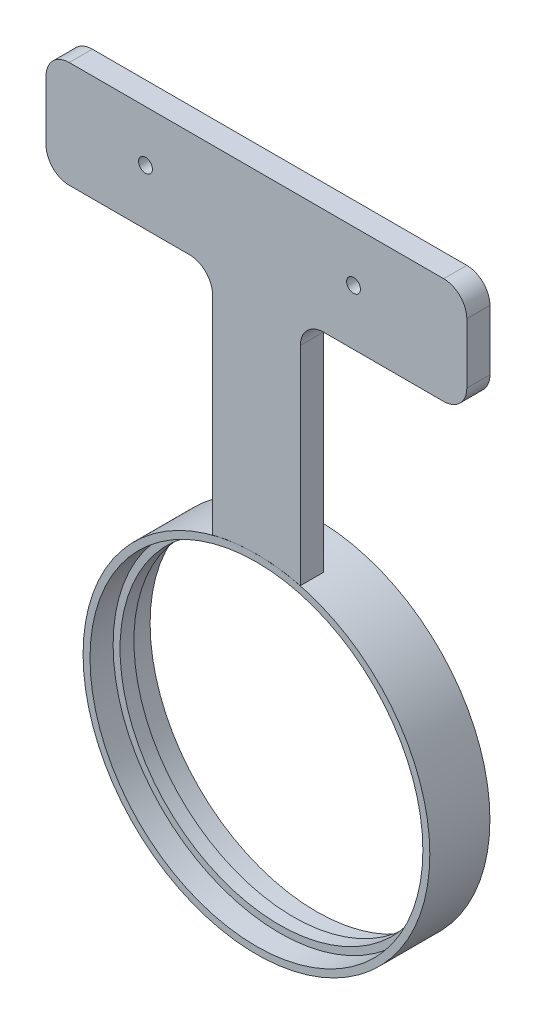
from build123d import *

# Parameters (mm, degrees)
ESQUISSE1_W                = 91
ESQUISSE1_H                = 73
BOSS_EXTRU_1_DEPTH         = 5
ENL_V_MAT_EXTRU_2_DEPTH    = 10
ENL_V_MAT_EXTRU_3_DEPTH    = 10
ESQUISSE4_R                = 37.5
BOSS_EXTRU_2_DEPTH         = 13
ESQUISSE5_R                = 36
ENL_V_MAT_EXTRU_4_DEPTH    = 5
R_P_TITION_LIN_AIRE1_COUNT = 2
R_P_TITION_LIN_AIRE1_PITCH = 8
ESQUISSE6_R                = 34.5
ENL_V_MAT_EXTRU_5_DEPTH    = 5
ENL_V_MAT_EXTRU_6_DEPTH    = 5
CONG_1_R                   = 5
ESQUISSE8_R                = 1.5
ENL_V_MAT_EXTRU_7_DEPTH    = 5


with BuildPart() as part:
    # Esquisse1 → Boss.-Extru.1 (new body)
    with BuildSketch(Plane.XY):
        with Locations((45.5, 36.5)):
            Rectangle(ESQUISSE1_W, ESQUISSE1_H)
    extrude(amount=BOSS_EXTRU_1_DEPTH)

    # Esquisse2 → Enlèv. mat.-Extru.2 (cut)
    with BuildSketch(Plane.XY.offset(5)):
        with BuildLine():
            Line((0, 0), (36, 0))
            Line((36, 0), (36, 45))
            ThreePointArc((36, 45), (34.535533906, 48.535533906), (31, 50))
            Line((31, 50), (5, 50))
            ThreePointArc((5, 50), (1.464466094, 51.464466094), (0, 55))
            Line((0, 55), (0, 50))
            Line((0, 50), (0, 0))
        make_face()
        with BuildLine():
            Line((86, 50), (60, 50))
            ThreePointArc((60, 50), (56.464466094, 48.535533906), (55, 45))
            Line((55, 45), (55, 0))
            Line((55, 0), (91, 0))
            Line((91, 0), (91, 50))
            Line((91, 50), (91, 55))
            ThreePointArc((91, 55), (89.535533906, 51.464466094), (86, 50))
        make_face()
    extrude(amount=-ENL_V_MAT_EXTRU_2_DEPTH, mode=Mode.SUBTRACT)

    # Esquisse3 → Enlèv. mat.-Extru.3 (cut)
    with BuildSketch(Plane.XY.offset(5)):
        with BuildLine():
            Line((36, 0), (55, 0))
            ThreePointArc((55, 0), (45.5, 1.184622268), (36, 0))
        make_face()
    extrude(amount=-ENL_V_MAT_EXTRU_3_DEPTH, mode=Mode.SUBTRACT)

    # Esquisse7 → Enlèv. mat.-Extru.6 (cut)
    with BuildSketch(Plane.XY.offset(5)):
        with BuildLine():
            ThreePointArc((0, 68), (1.464466094, 71.535533906), (5, 73))
            Line((5, 73), (0, 73))
            Line((0, 73), (0, 68))
        make_face()
    extrude(amount=-ENL_V_MAT_EXTRU_6_DEPTH, mode=Mode.SUBTRACT)

    # Congé1
    cong_1_edges = [part.edges().sort_by_distance(p)[0] for p in [
        (91, 73, 2.5),
    ]]
    fillet(cong_1_edges, radius=CONG_1_R)

    # Esquisse8 → Enlèv. mat.-Extru.7 (cut)
    with BuildSketch(Plane.XY.offset(5)):
        with Locations((21.5, 62)):
            Circle(ESQUISSE8_R)
        with Locations((66.5, 62)):
            Circle(ESQUISSE8_R)
    extrude(amount=-ENL_V_MAT_EXTRU_7_DEPTH, mode=Mode.SUBTRACT)


with BuildPart() as body_2:
    # Esquisse4 → Boss.-Extru.2 (new body)
    with BuildSketch(Plane.XY.offset(5)):
        with Locations((45.5, -36.315377732)):
            Circle(ESQUISSE4_R)
    extrude(amount=-BOSS_EXTRU_2_DEPTH)

    # Esquisse5 → Enlèv. mat.-Extru.4 (cut)
    with BuildSketch(Plane.XY.offset(5)):
        with Locations((45.5, -36.315377732)):
            Circle(ESQUISSE5_R)
    enl_v_mat_extru_4 = extrude(amount=-ENL_V_MAT_EXTRU_4_DEPTH, mode=Mode.SUBTRACT)

    # Répétition linéaire1: Enlèv. mat.-Extru.4 ×2
    with Locations(*[(0, 0, -i * R_P_TITION_LIN_AIRE1_PITCH) for i in range(1, R_P_TITION_LIN_AIRE1_COUNT)]):
        add(enl_v_mat_extru_4, mode=Mode.SUBTRACT)

    # Esquisse6 → Enlèv. mat.-Extru.5 (cut)
    with BuildSketch(Plane.XY):
        with Locations((45.5, -36.315377732)):
            Circle(ESQUISSE6_R)
    extrude(amount=-ENL_V_MAT_EXTRU_5_DEPTH, mode=Mode.SUBTRACT)


solid = Compound([part.part, body_2.part])
